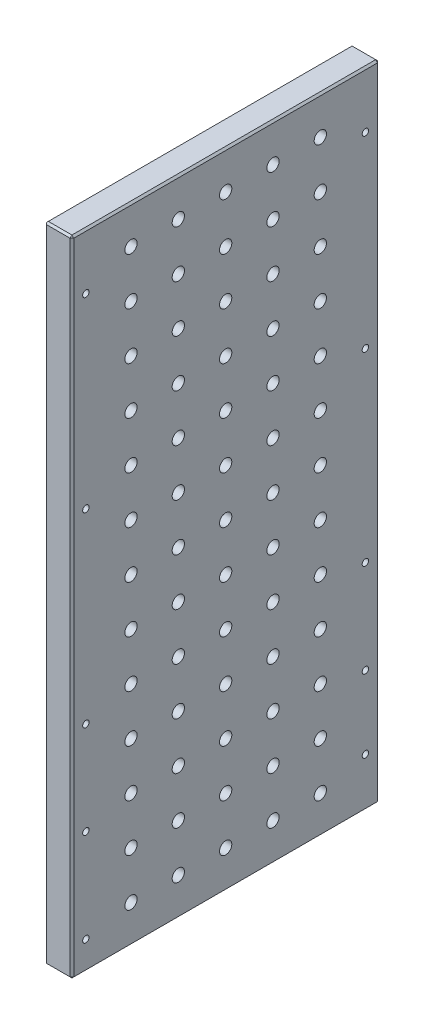
from build123d import *

# Parameters (mm, degrees)
SKETCH1_W           = 165
SKETCH1_H           = 345.3
SKETCH1_R           = 2.08
SKETCH1_R_2         = 3.3
BOSS_EXTRUDE1_DEPTH = 14.66
SKETCH2_R           = 5.5
CUT_EXTRUDE1_DEPTH  = 8
CHAMFER1_SIZE       = 1
CHAMFER2_SIZE       = 1
SKETCH3_R           = 3.08
SKETCH3_R_2         = 1.725
BOSS_EXTRUDE2_DEPTH = 14.66


with BuildPart() as part:
    # Sketch1 → Boss-Extrude1 (new body)
    with BuildSketch(Plane(origin=(137.16, 0, 0), x_dir=(0, 0, -1), z_dir=(1, 0, 0))):
        with Locations((0.001483153, 415.53)):
            Rectangle(SKETCH1_W, SKETCH1_H)
        with Locations((-75, 258.18)):
            Circle(SKETCH1_R, mode=Mode.SUBTRACT)
        with Locations((75, 269.112629148)):
            Circle(SKETCH1_R, mode=Mode.SUBTRACT)
        with Locations((75, 308.18)):
            Circle(SKETCH1_R, mode=Mode.SUBTRACT)
        with Locations((75, 358.268936421)):
            Circle(SKETCH1_R, mode=Mode.SUBTRACT)
        with Locations((-75, 308.18)):
            Circle(SKETCH1_R, mode=Mode.SUBTRACT)
        with Locations((-75, 358.18)):
            Circle(SKETCH1_R, mode=Mode.SUBTRACT)
        with Locations((75, 457.71566011)):
            Circle(SKETCH1_R, mode=Mode.SUBTRACT)
        with Locations((-75, 458.18)):
            Circle(SKETCH1_R, mode=Mode.SUBTRACT)
        with Locations((75, 558.18)):
            Circle(SKETCH1_R, mode=Mode.SUBTRACT)
        with Locations((-75, 558.18)):
            Circle(SKETCH1_R, mode=Mode.SUBTRACT)
        with Locations((-25.398516847, 517.13)):
            Circle(SKETCH1_R_2, mode=Mode.SUBTRACT)
        with Locations((50.801483153, 517.13)):
            Circle(SKETCH1_R_2, mode=Mode.SUBTRACT)
        with Locations((25.401483153, 517.13)):
            Circle(SKETCH1_R_2, mode=Mode.SUBTRACT)
        with Locations((50.801483153, 567.93)):
            Circle(SKETCH1_R_2, mode=Mode.SUBTRACT)
        with Locations((50.801483153, 542.53)):
            Circle(SKETCH1_R_2, mode=Mode.SUBTRACT)
        with Locations((0.001483153, 567.93)):
            Circle(SKETCH1_R_2, mode=Mode.SUBTRACT)
        with Locations((0.001483153, 517.13)):
            Circle(SKETCH1_R_2, mode=Mode.SUBTRACT)
        with Locations((25.401483153, 542.53)):
            Circle(SKETCH1_R_2, mode=Mode.SUBTRACT)
        with Locations((25.401483153, 567.93)):
            Circle(SKETCH1_R_2, mode=Mode.SUBTRACT)
        with Locations((-50.798516847, 567.93)):
            Circle(SKETCH1_R_2, mode=Mode.SUBTRACT)
        with Locations((-25.398516847, 567.93)):
            Circle(SKETCH1_R_2, mode=Mode.SUBTRACT)
        with Locations((0.001483153, 542.53)):
            Circle(SKETCH1_R_2, mode=Mode.SUBTRACT)
        with Locations((-50.798516847, 542.53)):
            Circle(SKETCH1_R_2, mode=Mode.SUBTRACT)
        with Locations((-50.798516847, 491.73)):
            Circle(SKETCH1_R_2, mode=Mode.SUBTRACT)
        with Locations((-25.398516847, 491.73)):
            Circle(SKETCH1_R_2, mode=Mode.SUBTRACT)
        with Locations((-25.398516847, 542.53)):
            Circle(SKETCH1_R_2, mode=Mode.SUBTRACT)
        with Locations((-50.798516847, 517.13)):
            Circle(SKETCH1_R_2, mode=Mode.SUBTRACT)
        with Locations((50.801483153, 415.53)):
            Circle(SKETCH1_R_2, mode=Mode.SUBTRACT)
        with Locations((50.801483153, 440.93)):
            Circle(SKETCH1_R_2, mode=Mode.SUBTRACT)
        with Locations((0.001483153, 415.53)):
            Circle(SKETCH1_R_2, mode=Mode.SUBTRACT)
        with Locations((25.401483153, 415.53)):
            Circle(SKETCH1_R_2, mode=Mode.SUBTRACT)
        with Locations((-25.398516847, 440.93)):
            Circle(SKETCH1_R_2, mode=Mode.SUBTRACT)
        with Locations((-50.798516847, 440.93)):
            Circle(SKETCH1_R_2, mode=Mode.SUBTRACT)
        with Locations((25.401483153, 440.93)):
            Circle(SKETCH1_R_2, mode=Mode.SUBTRACT)
        with Locations((0.001483153, 440.93)):
            Circle(SKETCH1_R_2, mode=Mode.SUBTRACT)
        with Locations((0.001483153, 466.33)):
            Circle(SKETCH1_R_2, mode=Mode.SUBTRACT)
        with Locations((25.401483153, 466.33)):
            Circle(SKETCH1_R_2, mode=Mode.SUBTRACT)
        with Locations((-50.798516847, 466.33)):
            Circle(SKETCH1_R_2, mode=Mode.SUBTRACT)
        with Locations((-25.398516847, 466.33)):
            Circle(SKETCH1_R_2, mode=Mode.SUBTRACT)
        with Locations((25.401483153, 491.73)):
            Circle(SKETCH1_R_2, mode=Mode.SUBTRACT)
        with Locations((0.001483153, 491.73)):
            Circle(SKETCH1_R_2, mode=Mode.SUBTRACT)
        with Locations((50.801483153, 466.33)):
            Circle(SKETCH1_R_2, mode=Mode.SUBTRACT)
        with Locations((50.801483153, 491.73)):
            Circle(SKETCH1_R_2, mode=Mode.SUBTRACT)
        with Locations((25.401483153, 390.13)):
            Circle(SKETCH1_R_2, mode=Mode.SUBTRACT)
        with Locations((0.001483153, 390.13)):
            Circle(SKETCH1_R_2, mode=Mode.SUBTRACT)
        with Locations((50.801483153, 364.73)):
            Circle(SKETCH1_R_2, mode=Mode.SUBTRACT)
        with Locations((50.801483153, 390.13)):
            Circle(SKETCH1_R_2, mode=Mode.SUBTRACT)
        with Locations((-50.798516847, 415.53)):
            Circle(SKETCH1_R_2, mode=Mode.SUBTRACT)
        with Locations((-25.398516847, 415.53)):
            Circle(SKETCH1_R_2, mode=Mode.SUBTRACT)
        with Locations((-25.398516847, 390.13)):
            Circle(SKETCH1_R_2, mode=Mode.SUBTRACT)
        with Locations((-50.798516847, 390.13)):
            Circle(SKETCH1_R_2, mode=Mode.SUBTRACT)
        with Locations((-25.398516847, 339.33)):
            Circle(SKETCH1_R_2, mode=Mode.SUBTRACT)
        with Locations((-50.798516847, 339.33)):
            Circle(SKETCH1_R_2, mode=Mode.SUBTRACT)
        with Locations((25.401483153, 339.33)):
            Circle(SKETCH1_R_2, mode=Mode.SUBTRACT)
        with Locations((0.001483153, 339.33)):
            Circle(SKETCH1_R_2, mode=Mode.SUBTRACT)
        with Locations((0.001483153, 364.73)):
            Circle(SKETCH1_R_2, mode=Mode.SUBTRACT)
        with Locations((25.401483153, 364.73)):
            Circle(SKETCH1_R_2, mode=Mode.SUBTRACT)
        with Locations((-50.798516847, 364.73)):
            Circle(SKETCH1_R_2, mode=Mode.SUBTRACT)
        with Locations((-25.398516847, 364.73)):
            Circle(SKETCH1_R_2, mode=Mode.SUBTRACT)
        with Locations((-50.798516847, 313.93)):
            Circle(SKETCH1_R_2, mode=Mode.SUBTRACT)
        with Locations((-25.398516847, 313.93)):
            Circle(SKETCH1_R_2, mode=Mode.SUBTRACT)
        with Locations((-25.398516847, 288.53)):
            Circle(SKETCH1_R_2, mode=Mode.SUBTRACT)
        with Locations((-50.798516847, 288.53)):
            Circle(SKETCH1_R_2, mode=Mode.SUBTRACT)
        with Locations((50.801483153, 313.93)):
            Circle(SKETCH1_R_2, mode=Mode.SUBTRACT)
        with Locations((50.801483153, 339.33)):
            Circle(SKETCH1_R_2, mode=Mode.SUBTRACT)
        with Locations((0.001483153, 313.93)):
            Circle(SKETCH1_R_2, mode=Mode.SUBTRACT)
        with Locations((25.401483153, 313.93)):
            Circle(SKETCH1_R_2, mode=Mode.SUBTRACT)
        with Locations((50.801483153, 288.53)):
            Circle(SKETCH1_R_2, mode=Mode.SUBTRACT)
        with Locations((50.801483153, 263.13)):
            Circle(SKETCH1_R_2, mode=Mode.SUBTRACT)
        with Locations((0.001483153, 288.53)):
            Circle(SKETCH1_R_2, mode=Mode.SUBTRACT)
        with Locations((25.401483153, 288.53)):
            Circle(SKETCH1_R_2, mode=Mode.SUBTRACT)
        with Locations((-25.398516847, 263.13)):
            Circle(SKETCH1_R_2, mode=Mode.SUBTRACT)
        with Locations((-50.798516847, 263.13)):
            Circle(SKETCH1_R_2, mode=Mode.SUBTRACT)
        with Locations((25.401483153, 263.13)):
            Circle(SKETCH1_R_2, mode=Mode.SUBTRACT)
        with Locations((0.001483153, 263.13)):
            Circle(SKETCH1_R_2, mode=Mode.SUBTRACT)
    extrude(amount=-BOSS_EXTRUDE1_DEPTH)

    # Sketch2 → Cut-Extrude1 (cut)
    with BuildSketch(Plane.ZY.offset(-122.5)):
        with Locations((-50.801483153, 263.13)):
            Circle(SKETCH2_R)
        with Locations((-25.401483153, 263.13)):
            Circle(SKETCH2_R)
        with Locations((-0.001483153, 263.13)):
            Circle(SKETCH2_R)
        with Locations((25.398516847, 263.13)):
            Circle(SKETCH2_R)
        with Locations((50.798516847, 263.13)):
            Circle(SKETCH2_R)
        with Locations((-25.401483153, 288.53)):
            Circle(SKETCH2_R)
        with Locations((-0.001483153, 288.53)):
            Circle(SKETCH2_R)
        with Locations((25.398516847, 288.53)):
            Circle(SKETCH2_R)
        with Locations((50.798516847, 288.53)):
            Circle(SKETCH2_R)
        with Locations((-25.401483153, 313.93)):
            Circle(SKETCH2_R)
        with Locations((-0.001483153, 313.93)):
            Circle(SKETCH2_R)
        with Locations((25.398516847, 313.93)):
            Circle(SKETCH2_R)
        with Locations((50.798516847, 313.93)):
            Circle(SKETCH2_R)
        with Locations((-25.401483153, 339.33)):
            Circle(SKETCH2_R)
        with Locations((-0.001483153, 339.33)):
            Circle(SKETCH2_R)
        with Locations((25.398516847, 339.33)):
            Circle(SKETCH2_R)
        with Locations((50.798516847, 339.33)):
            Circle(SKETCH2_R)
        with Locations((-25.401483153, 364.73)):
            Circle(SKETCH2_R)
        with Locations((-0.001483153, 364.73)):
            Circle(SKETCH2_R)
        with Locations((25.398516847, 364.73)):
            Circle(SKETCH2_R)
        with Locations((50.798516847, 364.73)):
            Circle(SKETCH2_R)
        with Locations((-25.401483153, 390.13)):
            Circle(SKETCH2_R)
        with Locations((-0.001483153, 390.13)):
            Circle(SKETCH2_R)
        with Locations((25.398516847, 390.13)):
            Circle(SKETCH2_R)
        with Locations((50.798516847, 390.13)):
            Circle(SKETCH2_R)
        with Locations((-25.401483153, 415.53)):
            Circle(SKETCH2_R)
        with Locations((-0.001483153, 415.53)):
            Circle(SKETCH2_R)
        with Locations((25.398516847, 415.53)):
            Circle(SKETCH2_R)
        with Locations((50.798516847, 415.53)):
            Circle(SKETCH2_R)
        with Locations((-25.401483153, 440.93)):
            Circle(SKETCH2_R)
        with Locations((-0.001483153, 440.93)):
            Circle(SKETCH2_R)
        with Locations((25.398516847, 440.93)):
            Circle(SKETCH2_R)
        with Locations((50.798516847, 440.93)):
            Circle(SKETCH2_R)
        with Locations((-25.401483153, 466.33)):
            Circle(SKETCH2_R)
        with Locations((-0.001483153, 466.33)):
            Circle(SKETCH2_R)
        with Locations((25.398516847, 466.33)):
            Circle(SKETCH2_R)
        with Locations((50.798516847, 466.33)):
            Circle(SKETCH2_R)
        with Locations((-25.401483153, 491.73)):
            Circle(SKETCH2_R)
        with Locations((-0.001483153, 491.73)):
            Circle(SKETCH2_R)
        with Locations((25.398516847, 491.73)):
            Circle(SKETCH2_R)
        with Locations((50.798516847, 491.73)):
            Circle(SKETCH2_R)
        with Locations((-25.401483153, 517.13)):
            Circle(SKETCH2_R)
        with Locations((-0.001483153, 517.13)):
            Circle(SKETCH2_R)
        with Locations((25.398516847, 517.13)):
            Circle(SKETCH2_R)
        with Locations((50.798516847, 517.13)):
            Circle(SKETCH2_R)
        with Locations((-25.401483153, 542.53)):
            Circle(SKETCH2_R)
        with Locations((-0.001483153, 542.53)):
            Circle(SKETCH2_R)
        with Locations((25.398516847, 542.53)):
            Circle(SKETCH2_R)
        with Locations((50.798516847, 542.53)):
            Circle(SKETCH2_R)
        with Locations((-25.401483153, 567.93)):
            Circle(SKETCH2_R)
        with Locations((-0.001483153, 567.93)):
            Circle(SKETCH2_R)
        with Locations((25.398516847, 567.93)):
            Circle(SKETCH2_R)
        with Locations((50.798516847, 567.93)):
            Circle(SKETCH2_R)
        with Locations((-50.801483153, 288.53)):
            Circle(SKETCH2_R)
        with Locations((-50.801483153, 313.93)):
            Circle(SKETCH2_R)
        with Locations((-50.801483153, 339.33)):
            Circle(SKETCH2_R)
        with Locations((-50.801483153, 364.73)):
            Circle(SKETCH2_R)
        with Locations((-50.801483153, 390.13)):
            Circle(SKETCH2_R)
        with Locations((-50.801483153, 415.53)):
            Circle(SKETCH2_R)
        with Locations((-50.801483153, 440.93)):
            Circle(SKETCH2_R)
        with Locations((-50.801483153, 466.33)):
            Circle(SKETCH2_R)
        with Locations((-50.801483153, 491.73)):
            Circle(SKETCH2_R)
        with Locations((-50.801483153, 517.13)):
            Circle(SKETCH2_R)
        with Locations((-50.801483153, 542.53)):
            Circle(SKETCH2_R)
        with Locations((-50.801483153, 567.93)):
            Circle(SKETCH2_R)
    extrude(amount=-CUT_EXTRUDE1_DEPTH, mode=Mode.SUBTRACT)

    # Chamfer1
    chamfer1_edges = [part.edges().sort_by_distance(p)[0] for p in [
        (122.5, 258.18, 77.08),
        (122.5, 588.18, -0.001483153),
        (122.5, 269.112629148, -72.92),
        (122.5, 415.53, 82.498516847),
        (122.5, 308.18, -72.92),
        (122.5, 358.268936421, -72.92),
        (122.5, 308.18, 77.08),
        (122.5, 358.18, 77.08),
        (122.5, 457.71566011, -72.92),
        (122.5, 458.18, 77.08),
        (122.5, 263.13, -30.901483153),
        (122.5, 263.13, -5.501483153),
        (122.5, 263.13, 19.898516847),
        (122.5, 263.13, 45.298516847),
        (122.5, 288.53, -30.901483153),
        (122.5, 288.53, -5.501483153),
        (122.5, 288.53, 19.898516847),
        (122.5, 288.53, 45.298516847),
        (122.5, 313.93, -30.901483153),
        (122.5, 313.93, -5.501483153),
        (122.5, 313.93, 19.898516847),
        (122.5, 558.18, -72.92),
        (122.5, 313.93, 45.298516847),
        (122.5, 339.33, -30.901483153),
        (122.5, 339.33, -5.501483153),
        (122.5, 339.33, 19.898516847),
        (122.5, 339.33, 45.298516847),
        (122.5, 364.73, -30.901483153),
        (122.5, 364.73, -5.501483153),
        (122.5, 364.73, 19.898516847),
        (122.5, 364.73, 45.298516847),
        (122.5, 390.13, -30.901483153),
        (122.5, 390.13, -5.501483153),
        (122.5, 390.13, 19.898516847),
        (122.5, 390.13, 45.298516847),
        (122.5, 415.53, -30.901483153),
        (122.5, 558.18, 77.08),
        (122.5, 415.53, -5.501483153),
        (122.5, 415.53, 19.898516847),
        (122.5, 415.53, 45.298516847),
        (122.5, 440.93, -30.901483153),
        (122.5, 440.93, -5.501483153),
        (122.5, 440.93, 19.898516847),
        (122.5, 440.93, 45.298516847),
        (122.5, 567.93, -30.901483153),
        (122.5, 567.93, -5.501483153),
        (122.5, 567.93, 19.898516847),
        (122.5, 567.93, 45.298516847),
        (122.5, 242.88, -0.001483153),
        (122.5, 288.53, -56.301483153),
        (122.5, 313.93, -56.301483153),
        (122.5, 339.33, -56.301483153),
        (122.5, 364.73, -56.301483153),
        (122.5, 390.13, -56.301483153),
        (122.5, 415.53, -56.301483153),
        (122.5, 440.93, -56.301483153),
        (122.5, 466.33, -56.301483153),
        (122.5, 491.73, -56.301483153),
        (122.5, 517.13, -56.301483153),
        (122.5, 542.53, -56.301483153),
        (122.5, 567.93, -56.301483153),
        (122.5, 542.53, 45.298516847),
        (122.5, 542.53, 19.898516847),
        (122.5, 542.53, -5.501483153),
        (122.5, 542.53, -30.901483153),
        (122.5, 517.13, 45.298516847),
        (122.5, 517.13, 19.898516847),
        (122.5, 517.13, -5.501483153),
        (122.5, 517.13, -30.901483153),
        (122.5, 491.73, 45.298516847),
        (122.5, 491.73, 19.898516847),
        (122.5, 491.73, -5.501483153),
        (122.5, 491.73, -30.901483153),
        (122.5, 466.33, 45.298516847),
        (122.5, 466.33, 19.898516847),
        (122.5, 466.33, -5.501483153),
        (122.5, 466.33, -30.901483153),
        (122.5, 263.13, -56.301483153),
        (122.5, 415.53, -82.501483153),
    ]]
    chamfer(chamfer1_edges, length=CHAMFER1_SIZE)

    # Chamfer2
    chamfer2_edges = [part.edges().sort_by_distance(p)[0] for p in [
        (137.16, 415.53, 82.498516847),
        (137.16, 588.18, -0.001483153),
        (137.16, 415.53, -82.501483153),
        (137.16, 242.88, -0.001483153),
        (130.33, 242.88, -82.501483153),
        (130.33, 588.18, -82.501483153),
        (130.33, 588.18, 82.498516847),
        (130.33, 242.88, 82.498516847),
    ]]
    chamfer(chamfer2_edges, length=CHAMFER2_SIZE)

    # Sketch3 → Boss-Extrude2 (add)
    # profile 1 of 10: a face of its own
    with BuildSketch(Plane.ZY.offset(-122.5)):
        with Locations((-75, 558.18)):
            Circle(SKETCH3_R)
        with Locations((-75, 558.18)):
            Circle(SKETCH3_R_2, mode=Mode.SUBTRACT)
    # profile 2 of 10: a face of its own
    with BuildSketch(Plane.ZY.offset(-122.5)):
        with Locations((75, 558.18)):
            Circle(SKETCH3_R)
        with Locations((75, 558.18)):
            Circle(SKETCH3_R_2, mode=Mode.SUBTRACT)
    # profile 3 of 10: a face of its own
    with BuildSketch(Plane.ZY.offset(-122.5)):
        with Locations((75, 458.18)):
            Circle(SKETCH3_R)
        with Locations((75, 458.18)):
            Circle(SKETCH3_R_2, mode=Mode.SUBTRACT)
    # profile 4 of 10: a face of its own
    with BuildSketch(Plane.ZY.offset(-122.5)):
        with Locations((-75, 457.71566011)):
            Circle(SKETCH3_R)
        with Locations((-75, 457.71566011)):
            Circle(SKETCH3_R_2, mode=Mode.SUBTRACT)
    # profile 5 of 10: a face of its own
    with BuildSketch(Plane.ZY.offset(-122.5)):
        with Locations((-75, 358.268936421)):
            Circle(SKETCH3_R)
        with Locations((-75, 358.268936421)):
            Circle(SKETCH3_R_2, mode=Mode.SUBTRACT)
    # profile 6 of 10: a face of its own
    with BuildSketch(Plane.ZY.offset(-122.5)):
        with Locations((75, 358.18)):
            Circle(SKETCH3_R)
        with Locations((75, 358.18)):
            Circle(SKETCH3_R_2, mode=Mode.SUBTRACT)
    # profile 7 of 10: a face of its own
    with BuildSketch(Plane.ZY.offset(-122.5)):
        with Locations((75, 308.18)):
            Circle(SKETCH3_R)
        with Locations((75, 308.18)):
            Circle(SKETCH3_R_2, mode=Mode.SUBTRACT)
    # profile 8 of 10: a face of its own
    with BuildSketch(Plane.ZY.offset(-122.5)):
        with Locations((75, 258.18)):
            Circle(SKETCH3_R)
        with Locations((75, 258.18)):
            Circle(SKETCH3_R_2, mode=Mode.SUBTRACT)
    # profile 9 of 10: a face of its own
    with BuildSketch(Plane.ZY.offset(-122.5)):
        with Locations((-75, 269.112629148)):
            Circle(SKETCH3_R)
        with Locations((-75, 269.112629148)):
            Circle(SKETCH3_R_2, mode=Mode.SUBTRACT)
    # profile 10 of 10: a face of its own
    with BuildSketch(Plane.ZY.offset(-122.5)):
        with Locations((-75, 308.18)):
            Circle(SKETCH3_R)
        with Locations((-75, 308.18)):
            Circle(SKETCH3_R_2, mode=Mode.SUBTRACT)
    extrude(amount=-BOSS_EXTRUDE2_DEPTH)


solid = part.part
